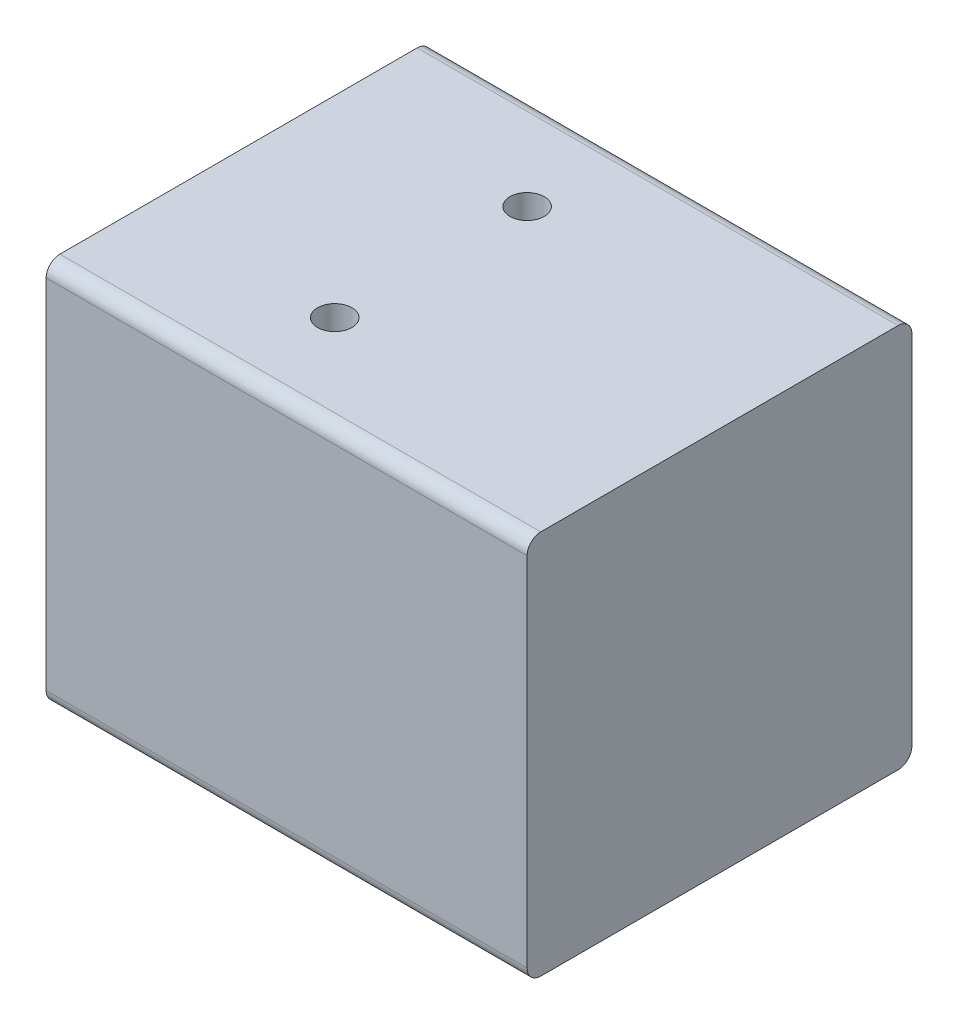
from build123d import *

# Parameters (mm, degrees)
SKETCH1_W                      = 111.125
SKETCH1_H                      = 88.9
BOSS_EXTRUDE1_DEPTH            = 88.9
FILLET1_R                      = 3.175
F_5_16_0_3125_DIAMETER_HOLE1_D = 7.9375


with BuildPart() as part:
    # Sketch1 → Boss-Extrude1 (new body)
    with BuildSketch(Plane.XY):
        with Locations((0, 44.45)):
            Rectangle(SKETCH1_W, SKETCH1_H)
    extrude(amount=BOSS_EXTRUDE1_DEPTH)

    # Fillet1
    fillet1_edges = [part.edges().sort_by_distance(p)[0] for p in [
        (0, 88.9, 88.9),
        (0, 88.9, 0),
        (0, 0, 0),
        (0, 0, 88.9),
    ]]
    fillet(fillet1_edges, radius=FILLET1_R)

    # 5/16 (0.3125) Diameter Hole1 (through all)
    with Locations(Plane(origin=(0, 88.9, 0), x_dir=(1, 0, 0), z_dir=(0, 1, 0))):
        with Locations((-11.1125, -22.225), (-11.1125, -66.675)):
            Hole(F_5_16_0_3125_DIAMETER_HOLE1_D / 2)


solid = part.part
